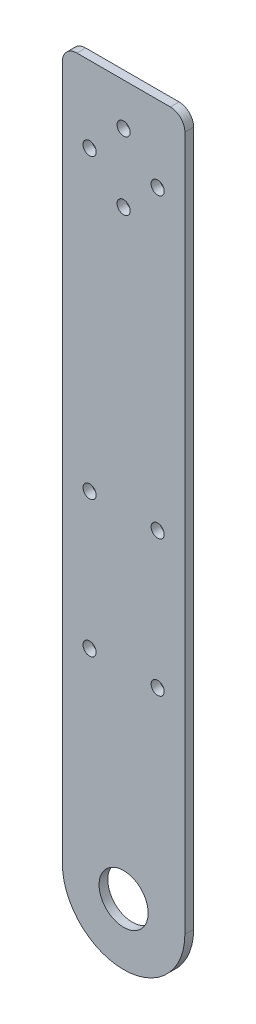
from build123d import *

# Parameters (mm, degrees)
ESBO_O1_R                = 1.35
ESBO_O1_R_2              = 5.05
RESSALTO_EXTRUS_O1_DEPTH = 1.8
FILETE1_R                = 3
FILETE2_R                = 3


with BuildPart() as part:
    # Esboço1 → Ressalto-extrusão1 (new body)
    with BuildSketch(Plane.XY):
        with BuildLine():
            Line((-12.596174938, 0), (-12.596174938, 145.832394841))
            Line((-12.596174938, 145.832394841), (12.596174938, 145.832394841))
            Line((12.596174938, 145.832394841), (12.596174938, 0))
            ThreePointArc((12.596174938, 0), (0, -12.596174938), (-12.596174938, 0))
        make_face()
        with Locations((7, 41.089981595)):
            Circle(ESBO_O1_R, mode=Mode.SUBTRACT)
        with Locations((7, 69.089981595)):
            Circle(ESBO_O1_R, mode=Mode.SUBTRACT)
        with Locations(Location((-7, 41.089981595, 0), (0, 0, 180))):
            Circle(ESBO_O1_R, mode=Mode.SUBTRACT)
        with Locations(Location((-7, 69.089981595, 0), (0, 0, 180))):
            Circle(ESBO_O1_R, mode=Mode.SUBTRACT)
        with Locations((7, 130.185826181)):
            Circle(ESBO_O1_R, mode=Mode.SUBTRACT)
        with Locations((0, 137.185826181)):
            Circle(ESBO_O1_R, mode=Mode.SUBTRACT)
        with Locations(Location((-7, 130.185826181, 0), (0, 0, 180))):
            Circle(ESBO_O1_R, mode=Mode.SUBTRACT)
        with Locations(Location((0, 123.185826181, 0), (0, 0, 180))):
            Circle(ESBO_O1_R, mode=Mode.SUBTRACT)
        Circle(ESBO_O1_R_2, mode=Mode.SUBTRACT)
    extrude(amount=RESSALTO_EXTRUS_O1_DEPTH)

    # Filete1
    filete1_edges = [part.edges().sort_by_distance(p)[0] for p in [
        (-12.596174938, 145.832394841, 0.9),
    ]]
    fillet(filete1_edges, radius=FILETE1_R)

    # Filete2
    filete2_edges = [part.edges().sort_by_distance(p)[0] for p in [
        (12.596174938, 145.832394841, 0.9),
    ]]
    fillet(filete2_edges, radius=FILETE2_R)


solid = part.part
